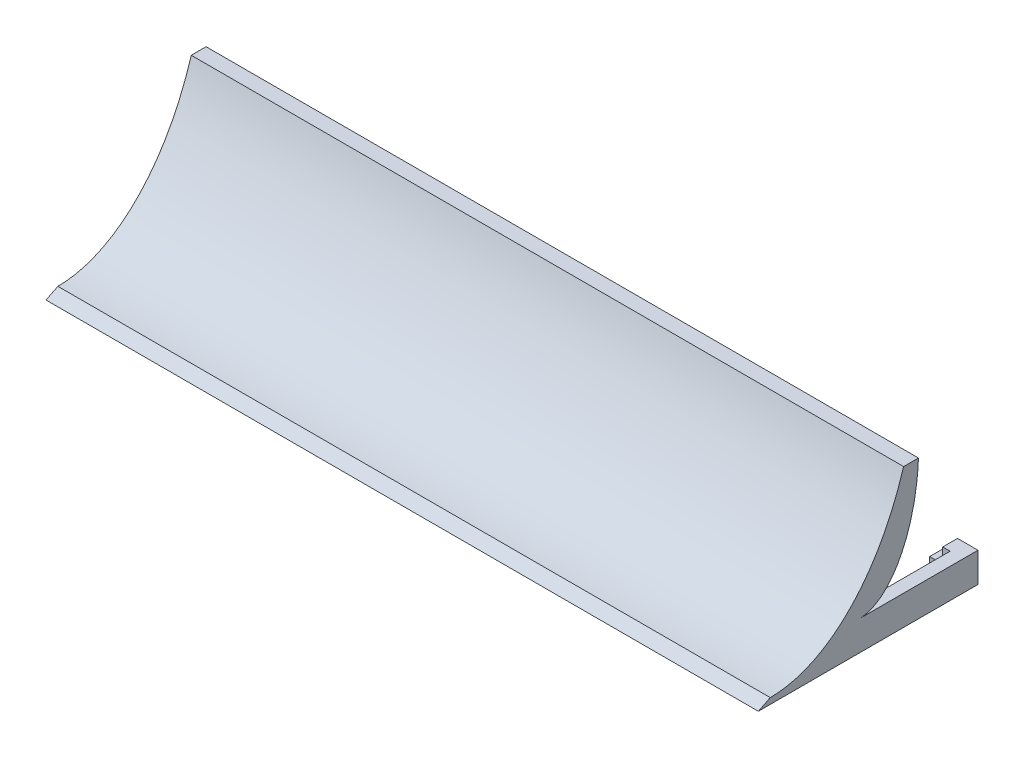
from build123d import *

# Parameters (mm, degrees)
CUCHILLA_SALIENTE_DEPTH                  = 60
CUCHILLA_SALIENTE_DEPTH_BACK             = 60
ENCAJE_CUCHILLA_LATERAL_CROQUIS_1_W      = 20
ENCAJE_CUCHILLA_LATERAL_CROQUIS_1_H      = 5
ENCAJE_CUCHILLA_LATERAL_SALIENTE_1_DEPTH = 2.2
ENCAJE_CUCHILLA_LATERAL_CROQUIS_2_W      = 20
ENCAJE_CUCHILLA_LATERAL_CROQUIS_2_H      = 2.5
ENCAJE_CUCHILLA_LATERAL_SALIENTE_2_DEPTH = 2.2
ENCAJE_CUCHILLA_LATERAL_CROQUIS_3_W      = 2.5
ENCAJE_CUCHILLA_LATERAL_CROQUIS_3_H      = 1.25
ENCAJE_CUCHILLA_LATERAL_SALIENTE_3_DEPTH = 1.25
ENCAJE_CUCHILLA_LATERAL_CROQUIS_4_W      = 2.5
ENCAJE_CUCHILLA_LATERAL_CROQUIS_4_H      = 1.25
ENCAJE_CUCHILLA_LATERAL_SALIENTE_4_DEPTH = 1.25
ENCAJE_CUCHILLA_LATERAL_CROQUIS_5_W      = 20
ENCAJE_CUCHILLA_LATERAL_CROQUIS_5_H      = 5
ENCAJE_CUCHILLA_LATERAL_SALIENTE_5_DEPTH = 2.2
ENCAJE_CUCHILLA_LATERAL_CROQUIS_6_W      = 20
ENCAJE_CUCHILLA_LATERAL_CROQUIS_6_H      = 2.5
ENCAJE_CUCHILLA_LATERAL_SALIENTE_6_DEPTH = 2.2
ENCAJE_CUCHILLA_LATERAL_CROQUIS_7_W      = 2.5
ENCAJE_CUCHILLA_LATERAL_CROQUIS_7_H      = 1.25
ENCAJE_CUCHILLA_LATERAL_SALIENTE_7_DEPTH = 1.25
ENCAJE_CUCHILLA_LATERAL_CROQUIS_8_W      = 2.5
ENCAJE_CUCHILLA_LATERAL_CROQUIS_8_H      = 1.25
ENCAJE_CUCHILLA_LATERAL_SALIENTE_8_DEPTH = 1.25
ENCAJE_CUCHILLA_CENTRAL_SALIENTE_DEPTH   = 20


with BuildPart() as part:
    # Croquis4 → Cuchilla-Saliente (new, two sides: drawn at the far end of the back side and taken through both)
    with BuildSketch(Plane(origin=(0, 0, 0), x_dir=(0, 0, -1), z_dir=(1, 0, 0)).offset(-CUCHILLA_SALIENTE_DEPTH_BACK)):
        with BuildLine():
            Line((9.97060468, 23.467626264), (7.47060468, 23.467626264))
            add(Edge.make_bspline(
                [(-15, 1), (0.62292895, 1), (7.47060468, 23.467626264)],
                knots=[0, 0, 0, 1.117079483, 1.117079483, 1.117079483], degree=2, weights=[1, 0.848029877, 1]))
            Line((-15, 1), (-17, 0))
            Line((-17, 0), (0, 0))
            Line((0, 0), (0, 5))
            add(Edge.make_bspline(
                [(0, 5), (9.261036245, 5), (9.97060468, 23.467626264)],
                knots=[0, 0, 0, 1.494102477, 1.494102477, 1.494102477], degree=2, weights=[1, 0.733695675, 1]))
        make_face()
    extrude(amount=CUCHILLA_SALIENTE_DEPTH + CUCHILLA_SALIENTE_DEPTH_BACK)

    # Encaje-Cuchilla-Lateral-Croquis-1 → Encaje-Cuchilla-Lateral-Saliente-1 (add)
    with BuildSketch(Plane(origin=(60, 0, 0), x_dir=(0, 0, -1), z_dir=(1, 0, 0))):
        with Locations((10, 2.5)):
            Rectangle(ENCAJE_CUCHILLA_LATERAL_CROQUIS_1_W, ENCAJE_CUCHILLA_LATERAL_CROQUIS_1_H)
    extrude(amount=-ENCAJE_CUCHILLA_LATERAL_SALIENTE_1_DEPTH)

    # Encaje-Cuchilla-Lateral-Croquis-2 → Encaje-Cuchilla-Lateral-Saliente-2 (add)
    with BuildSketch(Plane.ZY.offset(-57.8)):
        with Locations((-10, 1.25)):
            Rectangle(ENCAJE_CUCHILLA_LATERAL_CROQUIS_2_W, ENCAJE_CUCHILLA_LATERAL_CROQUIS_2_H)
    extrude(amount=ENCAJE_CUCHILLA_LATERAL_SALIENTE_2_DEPTH)

    # Encaje-Cuchilla-Lateral-Croquis-3 → Encaje-Cuchilla-Lateral-Saliente-3 (add)
    with BuildSketch(Plane.ZY.offset(-55.6)):
        with Locations((-18.75, 1.875)):
            Rectangle(ENCAJE_CUCHILLA_LATERAL_CROQUIS_3_W, ENCAJE_CUCHILLA_LATERAL_CROQUIS_3_H)
    extrude(amount=ENCAJE_CUCHILLA_LATERAL_SALIENTE_3_DEPTH)

    # Encaje-Cuchilla-Lateral-Croquis-4 → Encaje-Cuchilla-Lateral-Saliente-4 (add)
    with BuildSketch(Plane.ZY.offset(-57.8)):
        with Locations((-18.75, 4.375)):
            Rectangle(ENCAJE_CUCHILLA_LATERAL_CROQUIS_4_W, ENCAJE_CUCHILLA_LATERAL_CROQUIS_4_H)
    extrude(amount=ENCAJE_CUCHILLA_LATERAL_SALIENTE_4_DEPTH)



with BuildPart() as body_2:
    # Encaje-Cuchilla-Lateral-Croquis-5 → Encaje-Cuchilla-Lateral-Saliente-5 (new body)
    with BuildSketch(Plane.ZY.offset(60)):
        with Locations((-10, 2.5)):
            Rectangle(ENCAJE_CUCHILLA_LATERAL_CROQUIS_5_W, ENCAJE_CUCHILLA_LATERAL_CROQUIS_5_H)
    extrude(amount=-ENCAJE_CUCHILLA_LATERAL_SALIENTE_5_DEPTH)


with BuildPart() as part_1:
    add(part.part)

    add(body_2.part)  # Encaje-Cuchilla-Lateral-Saliente-6 merges body 2
    # Encaje-Cuchilla-Lateral-Croquis-6 → Encaje-Cuchilla-Lateral-Saliente-6 (add)
    with BuildSketch(Plane(origin=(-57.8, 0, 0), x_dir=(0, 0, -1), z_dir=(1, 0, 0))):
        with Locations((10, 1.25)):
            Rectangle(ENCAJE_CUCHILLA_LATERAL_CROQUIS_6_W, ENCAJE_CUCHILLA_LATERAL_CROQUIS_6_H)
    extrude(amount=ENCAJE_CUCHILLA_LATERAL_SALIENTE_6_DEPTH)

    # Encaje-Cuchilla-Lateral-Croquis-7 → Encaje-Cuchilla-Lateral-Saliente-7 (add)
    with BuildSketch(Plane(origin=(-57.8, 0, 0), x_dir=(0, 0, -1), z_dir=(1, 0, 0))):
        with Locations((18.75, 4.375)):
            Rectangle(ENCAJE_CUCHILLA_LATERAL_CROQUIS_7_W, ENCAJE_CUCHILLA_LATERAL_CROQUIS_7_H)
    extrude(amount=ENCAJE_CUCHILLA_LATERAL_SALIENTE_7_DEPTH)

    # Encaje-Cuchilla-Lateral-Croquis-8 → Encaje-Cuchilla-Lateral-Saliente-8 (add)
    with BuildSketch(Plane(origin=(-55.6, 0, 0), x_dir=(0, 0, -1), z_dir=(1, 0, 0))):
        with Locations((18.75, 1.875)):
            Rectangle(ENCAJE_CUCHILLA_LATERAL_CROQUIS_8_W, ENCAJE_CUCHILLA_LATERAL_CROQUIS_8_H)
    extrude(amount=ENCAJE_CUCHILLA_LATERAL_SALIENTE_8_DEPTH)

    # Encaje-Cuchilla-Central-Croquis → Encaje-Cuchilla-Central-Saliente (add)
    with BuildSketch(Plane(origin=(0, 0, 0), x_dir=(-1, 0, 0), z_dir=(0, 0, -1))):
        Polygon((2.5, 3.125), (5, 3.125), (5, 1.875), (2.5, 1.875), (2.5, 0), (-2.5, 0), (-2.5, 1.875), (-5, 1.875), (-5, 3.125), (-2.5, 3.125), (-2.5, 5), (2.5, 5), align=None)
    extrude(amount=ENCAJE_CUCHILLA_CENTRAL_SALIENTE_DEPTH)


solid = part_1.part
